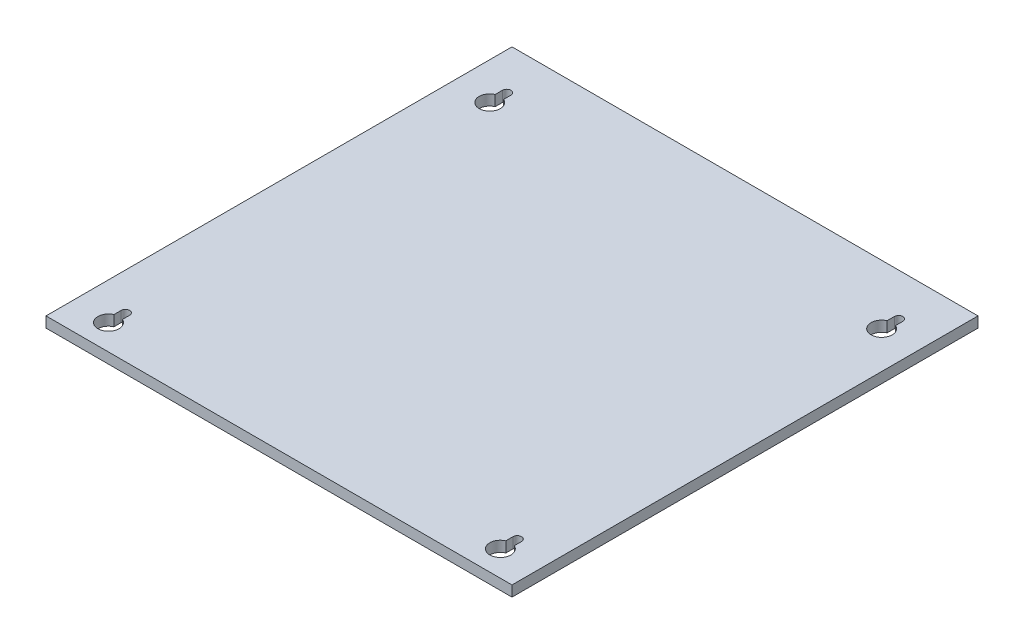
from build123d import *

# Parameters (mm, degrees)
SKETCH1_W            = 279.4
SKETCH1_H            = 279.4
BOSS_EXTRUDE1_DEPTH  = 6.35
CUT_EXTRUDE1_DEPTH   = 198.667656687
LPATTERN1_COUNT      = 2
LPATTERN1_PITCH      = 234.95
LPATTERN1_COUNT_DIR2 = 2
LPATTERN1_PITCH_DIR2 = 228.6


with BuildPart() as part:
    # Sketch1 → Boss-Extrude1 (new body)
    with BuildSketch(Plane(origin=(0, 0, 0), x_dir=(1, 0, 0), z_dir=(0, 1, 0))):
        Rectangle(SKETCH1_W, SKETCH1_H)
    extrude(amount=BOSS_EXTRUDE1_DEPTH)

    # Sketch2 → Cut-Extrude1 (cut, through all)
    with BuildSketch(Plane(origin=(0, 6.35, 0), x_dir=(1, 0, 0), z_dir=(0, 1, 0))):
        with BuildLine():
            Line((-114.935, 114.3), (-114.935, 109.959871133))
            ThreePointArc((-114.935, 109.959871133), (-117.475, 97.79), (-120.015, 109.959871133))
            Line((-120.015, 109.959871133), (-120.015, 114.3))
            ThreePointArc((-120.015, 114.3), (-117.475, 116.84), (-114.935, 114.3))
        make_face()
    cut_extrude1 = extrude(amount=-CUT_EXTRUDE1_DEPTH, mode=Mode.SUBTRACT)

    # LPattern1: Cut-Extrude1 2 × 2
    with Locations(*[(i * LPATTERN1_PITCH, 0, j * LPATTERN1_PITCH_DIR2) for i in range(LPATTERN1_COUNT) for j in range(LPATTERN1_COUNT_DIR2) if (i, j) != (0, 0)]):
        add(cut_extrude1, mode=Mode.SUBTRACT)


solid = part.part
